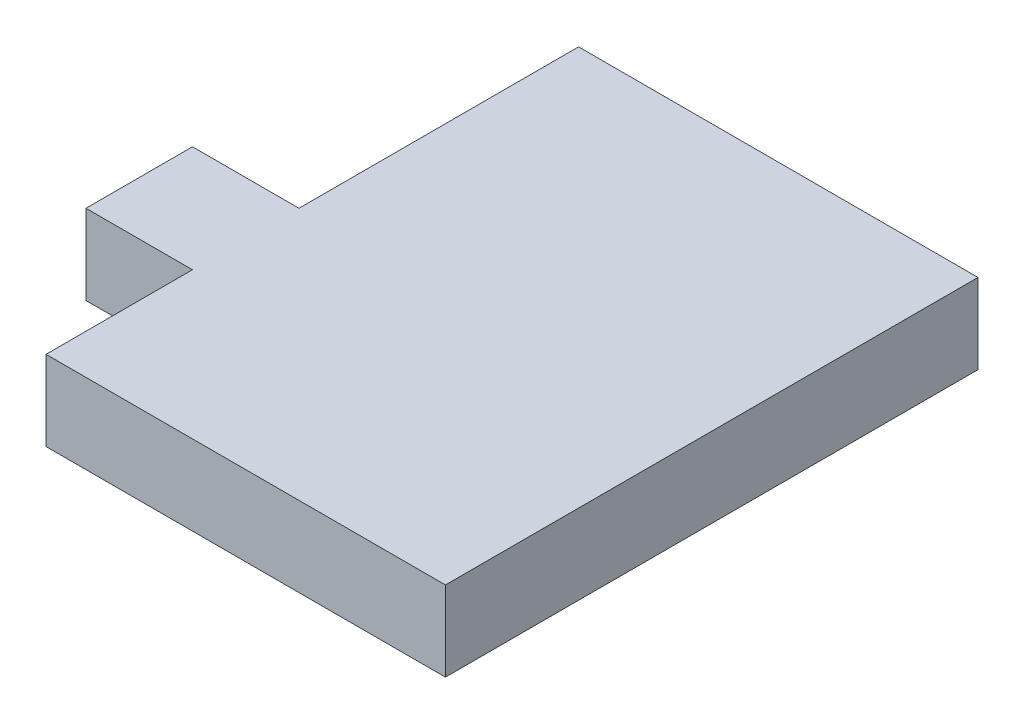
from build123d import *

# Parameters (mm, degrees)
BOSS_EXTRUDE1_DEPTH = 0.3


with BuildPart() as part:
    # Sketch1 → Boss-Extrude1 (new body)
    with BuildSketch(Plane(origin=(0, 0, 0), x_dir=(1, 0, 0), z_dir=(0, 1, 0))):
        Polygon((0, 2), (-1.5, 2), (-1.5, 0.95), (-1.9, 0.95), (-1.9, 0.55), (-1.5, 0.55), (-1.5, 0), (0, 0), align=None)
    extrude(amount=BOSS_EXTRUDE1_DEPTH)


solid = part.part
